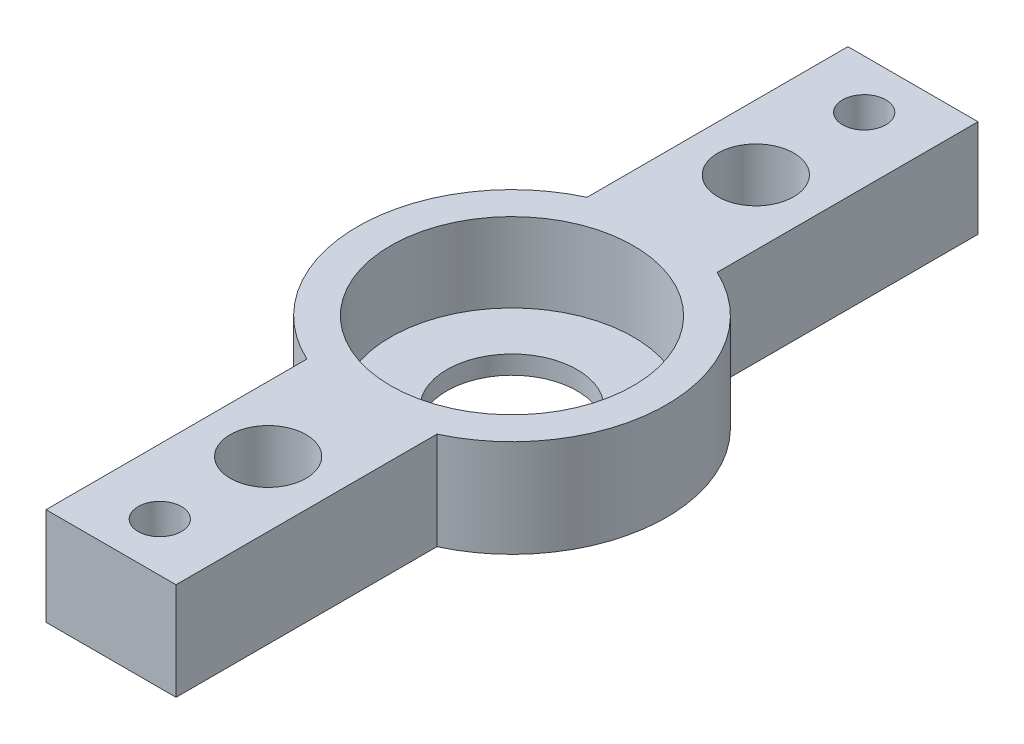
from build123d import *

# Parameters (mm, degrees)
SKETCH1_R           = 3.5
SKETCH1_R_2         = 2
BOSS_EXTRUDE1_DEPTH = 9
SKETCH2_R           = 11.2
CUT_EXTRUDE1_DEPTH  = 7.3
CUT_EXTRUDE2_REACH  = 42.316
SKETCH3_R           = 6


with BuildPart() as part:
    # Sketch1 → Boss-Extrude1 (new body)
    with BuildSketch(Plane(origin=(0, 0, 0), x_dir=(1, 0, 0), z_dir=(0, 1, 0))):
        with BuildLine():
            Line((-6, 37), (6, 37))
            Line((6, 37), (6, 12.925265955))
            ThreePointArc((6, 12.925265955), (14.25, 0), (6, -12.925265955))
            Line((6, -12.925265955), (6, -37))
            Line((6, -37), (-6, -37))
            Line((-6, -37), (-6, -12.925265955))
            ThreePointArc((-6, -12.925265955), (-14.25, 0), (-6, 12.925265955))
            Line((-6, 12.925265955), (-6, 37))
        make_face()
        with Locations(Location((0, 22.5, 0), (0, 0, 270))):
            Circle(SKETCH1_R, mode=Mode.SUBTRACT)
        with Locations(Location((0, 32.5, 0), (0, 0, 270))):
            Circle(SKETCH1_R_2, mode=Mode.SUBTRACT)
        with Locations(Location((0, -22.5, 0), (0, 0, 90))):
            Circle(SKETCH1_R, mode=Mode.SUBTRACT)
        with Locations(Location((0, -32.5, 0), (0, 0, 90))):
            Circle(SKETCH1_R_2, mode=Mode.SUBTRACT)
    extrude(amount=BOSS_EXTRUDE1_DEPTH)

    # Sketch2 → Cut-Extrude1 (cut)
    with BuildSketch(Plane(origin=(0, 9, 0), x_dir=(1, 0, 0), z_dir=(0, 1, 0))):
        with Locations(Location((0, 0, 0), (0, 0, 270))):
            Circle(SKETCH2_R)
    extrude(amount=-CUT_EXTRUDE1_DEPTH, mode=Mode.SUBTRACT)

    # Sketch3 → Cut-Extrude2 (cut, up to next)
    with BuildSketch(Plane(origin=(0, 1.7, 0), x_dir=(1, 0, 0), z_dir=(0, 1, 0)), mode=Mode.PRIVATE) as cut_extrude2_sk1:
        with Locations(Location((0, 0, 0), (0, 0, 270))):
            Circle(SKETCH3_R)
    cut_extrude2_tool1 = extrude(cut_extrude2_sk1.sketch, amount=-CUT_EXTRUDE2_REACH, mode=Mode.PRIVATE) & part.part
    add(cut_extrude2_tool1.solids().sort_by_distance((0, 1.7, 0))[0], mode=Mode.SUBTRACT)


solid = part.part
